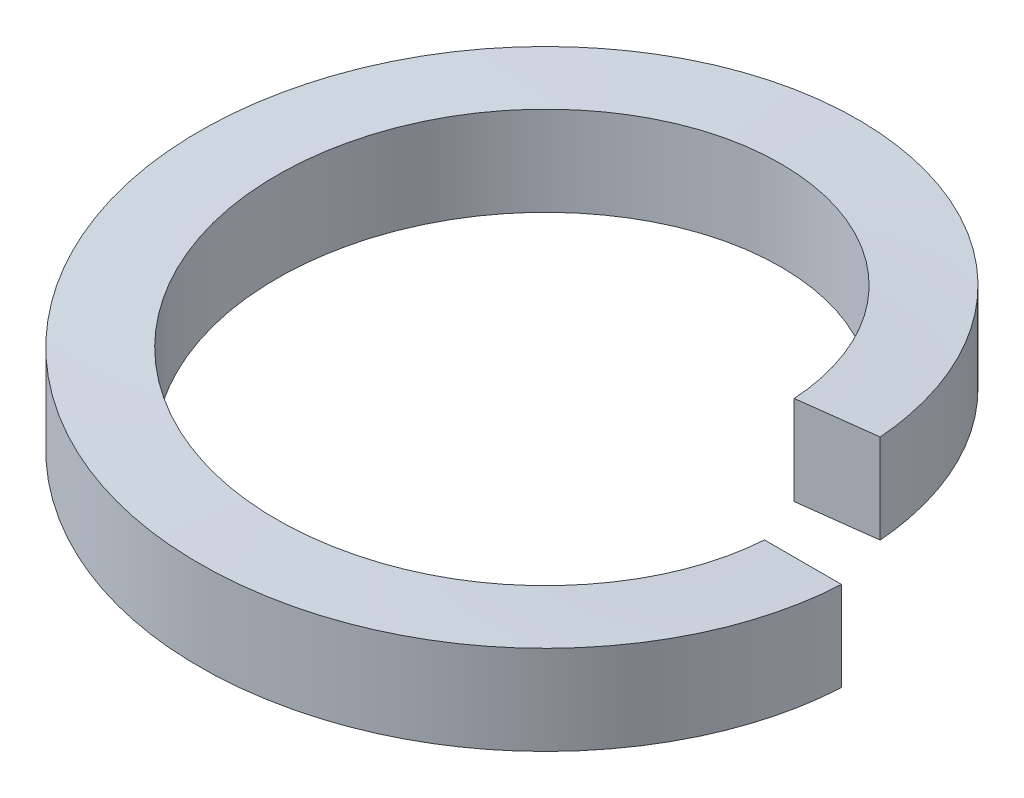
from build123d import *

# Parameters (mm, degrees)
SWEEP1_PITCH       = 1.4
SWEEP1_HEIGHT      = 1.372
SWEEP1_RADIUS      = 3.28
SWEEP1_START_ANGLE = 90
SKETCH1_W          = 1
SKETCH1_H          = 1.16


with BuildPart() as part:
    # Sweep1: sweep along a helix
    with BuildLine() as sweep1_path:
        add(Helix(SWEEP1_PITCH, SWEEP1_HEIGHT, SWEEP1_RADIUS, center=(0, 0, 0), direction=(0, 1, 0), lefthand=True, mode=Mode.PRIVATE).rotate(Axis((0, 0, 0), (0, 1, 0)), SWEEP1_START_ANGLE))
    # Sketch1 → Sweep1 (sweep)
    with BuildSketch(Plane.XY):
        with Locations((3.78, 0.58)):
            Rectangle(SKETCH1_W, SKETCH1_H)
    sweep(path=sweep1_path.line, is_frenet=True)


solid = part.part
